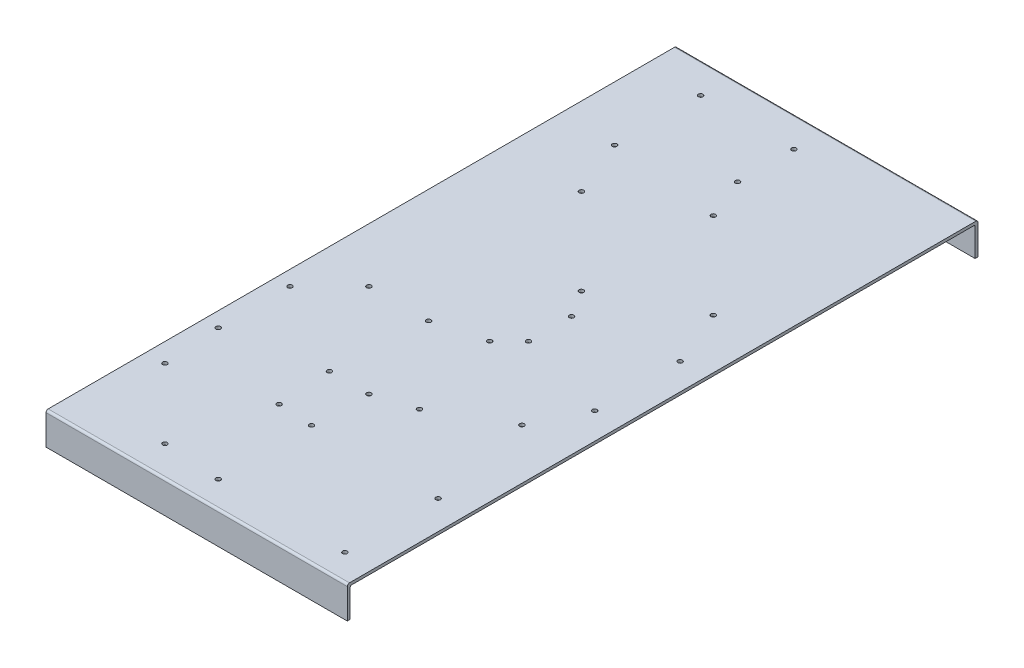
from build123d import *

# Parameters (mm, degrees)
SKETCH1_W           = 210
SKETCH1_H           = 439.61
BOSS_EXTRUDE1_DEPTH = 2
SKETCH2_W           = 210
SKETCH2_H           = 2
BOSS_EXTRUDE2_DEPTH = 20.32
FILLET1_R           = 1
FILLET2_R           = 1.5
SKETCH4_R           = 1.6
CUT_EXTRUDE1_DEPTH  = 1134.166859304


with BuildPart() as part:
    # Sketch1 → Boss-Extrude1 (new body)
    with BuildSketch(Plane(origin=(0, 0, 0), x_dir=(1, 0, 0), z_dir=(0, 1, 0))):
        with Locations((988.720815229, 75.734721456)):
            Rectangle(SKETCH1_W, SKETCH1_H)
    extrude(amount=BOSS_EXTRUDE1_DEPTH)

    # Sketch2 → Boss-Extrude2 (add)
    with BuildSketch(Plane.XZ):
        with Locations((988.720815229, 143.070278544)):
            Rectangle(SKETCH2_W, SKETCH2_H)
        with Locations((988.720815229, -294.539721456)):
            Rectangle(SKETCH2_W, SKETCH2_H)
    extrude(amount=BOSS_EXTRUDE2_DEPTH)

    # Fillet1
    fillet1_edges = [part.edges().sort_by_distance(p)[0] for p in [
        (988.720815229, 0, 142.070278544),
        (988.720815229, 0, -293.539721456),
    ]]
    fillet(fillet1_edges, radius=FILLET1_R)

    # Fillet2
    fillet2_edges = [part.edges().sort_by_distance(p)[0] for p in [
        (988.720815229, 2, 144.070278544),
        (988.720815229, 2, -295.539721456),
    ]]
    fillet(fillet2_edges, radius=FILLET2_R)

    # Sketch4 → Cut-Extrude1 (cut, through all)
    with BuildSketch(Plane(origin=(0, 2, 0), x_dir=(1, 0, 0), z_dir=(0, 1, 0))):
        with Locations(Location((921.920815229, 214.039721456, 0), (0, 0, 270))):
            Circle(SKETCH4_R)
        with Locations(Location((921.920815229, 274.039721456, 0), (0, 0, 270))):
            Circle(SKETCH4_R)
        with Locations(Location((986.920815229, 234.750399575, 0), (0, 0, 270))):
            Circle(SKETCH4_R)
        with Locations(Location((986.920815229, 274.039721456, 0), (0, 0, 270))):
            Circle(SKETCH4_R)
        with Locations(Location((1010.309162877, 65.651373808, 0), (0, 0, 270))):
            Circle(SKETCH4_R)
        with Locations(Location((1010.309162877, 95.651373808, 0), (0, 0, 270))):
            Circle(SKETCH4_R)
        with Locations(Location((986.565606348, -21.848626192, 0), (0, 0, 270))):
            Circle(SKETCH4_R)
        with Locations(Location((959.065606348, -21.848626192, 0), (0, 0, 270))):
            Circle(SKETCH4_R)
        with Locations(Location((963.168146726, 43.151373808, 0), (0, 0, 270))):
            Circle(SKETCH4_R)
        with Locations(Location((921.565606348, 43.151373808, 0), (0, 0, 270))):
            Circle(SKETCH4_R)
        with Locations(Location((894.065606348, -34.348626192, 0), (0, 0, 270))):
            Circle(SKETCH4_R)
        with Locations(Location((894.065606348, 15.651373808, 0), (0, 0, 270))):
            Circle(SKETCH4_R)
        with Locations(Location((961.370669454, -59.263980407, 0), (0, 0, 270))):
            Circle(SKETCH4_R)
        with Locations(Location((945.453731167, -122.879875269, 0), (0, 0, 270))):
            Circle(SKETCH4_R)
        with Locations(Location((896.92248209, -74.348626192, 0), (0, 0, 270))):
            Circle(SKETCH4_R)
        with Locations(Location((1073.720815229, -60.736751011, 0), (0, 0, 270))):
            Circle(SKETCH4_R)
        with Locations(Location((985.453731167, -60.736751011, 0), (0, 0, 270))):
            Circle(SKETCH4_R)
        with Locations(Location((1073.720815229, -125.736751011, 0), (0, 0, 270))):
            Circle(SKETCH4_R)
        with Locations(Location((985.453731167, -125.736751011, 0), (0, 0, 270))):
            Circle(SKETCH4_R)
        with Locations(Location((1013.305977837, -13.343657344, 0), (0, 0, 270))):
            Circle(SKETCH4_R)
        with Locations(Location((1058.564216667, 12.786773537, 0), (0, 0, 270))):
            Circle(SKETCH4_R)
        with Locations(Location((996.746475218, 52.151079456, 0), (0, 0, 270))):
            Circle(SKETCH4_R)
        with Locations(Location((938.352910915, 174.501024052, 0), (0, 0, 270))):
            Circle(SKETCH4_R)
        with Locations(Location((998.456987316, 114.396947651, 0), (0, 0, 270))):
            Circle(SKETCH4_R)
        with Locations(Location((998.866251712, 205.91156481, 0), (0, 0, 270))):
            Circle(SKETCH4_R)
        with Locations(Location((1058.970328113, 145.807488409, 0), (0, 0, 270))):
            Circle(SKETCH4_R)
        with Locations(Location((1075.308219227, 106.361698083, 0), (0, 0, 270))):
            Circle(SKETCH4_R)
        with Locations(Location((1075.305408117, 46.781698149, 0), (0, 0, 270))):
            Circle(SKETCH4_R)
    extrude(amount=-CUT_EXTRUDE1_DEPTH, mode=Mode.SUBTRACT)


solid = part.part
